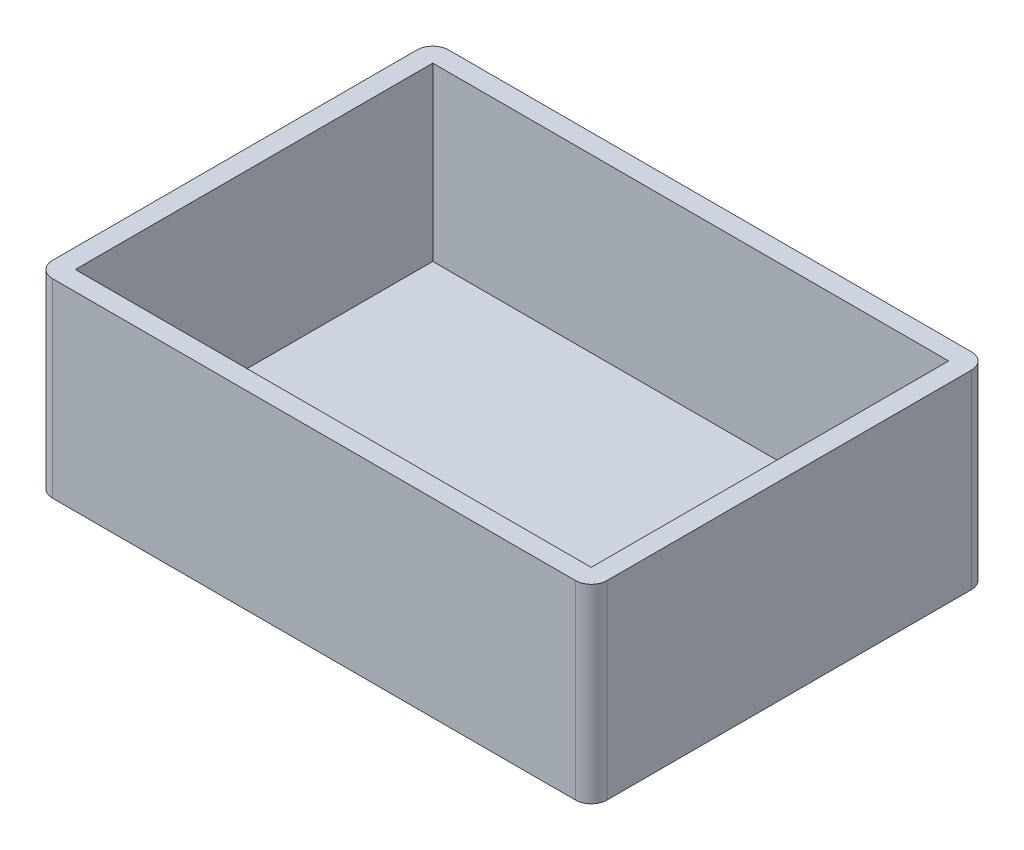
from build123d import *

# Parameters (mm, degrees)
SKETCH1_W                = 350
SKETCH1_H                = 250
SKETCH1_W_2              = 325.6
SKETCH1_H_2              = 225.61
BOSS_EXTRUDE1_DEPTH      = 120
SKETCH1_2_W              = 325.6
SKETCH1_2_H              = 225.61
BOSS_EXTRUDE2_DEPTH      = 11.6
FILLET1_R                = 10
M8_CLEARANCE_HOLE1_D     = 8.4
M8_CLEARANCE_HOLE1_DEPTH = 8
M8_CLEARANCE_HOLE1_TIP   = 2.5236146


with BuildPart() as part:
    # Sketch1 → Boss-Extrude1 (new body)
    with BuildSketch(Plane(origin=(0, 0, 0), x_dir=(1, 0, 0), z_dir=(0, 1, 0))):
        Rectangle(SKETCH1_W, SKETCH1_H)
        Rectangle(SKETCH1_W_2, SKETCH1_H_2, mode=Mode.SUBTRACT)
    extrude(amount=BOSS_EXTRUDE1_DEPTH)

    # Sketch1<2> → Boss-Extrude2 (add)
    with BuildSketch(Plane(origin=(0, 0, 0), x_dir=(1, 0, 0), z_dir=(0, 1, 0))):
        Rectangle(SKETCH1_2_W, SKETCH1_2_H)
    extrude(amount=BOSS_EXTRUDE2_DEPTH)

    # Fillet1
    fillet1_edges = [part.edges().sort_by_distance(p)[0] for p in [
        (175, 60, 125),
        (-175, 60, 125),
        (-175, 60, -125),
        (175, 60, -125),
    ]]
    fillet(fillet1_edges, radius=FILLET1_R)

    # M8 Clearance Hole1
    with Locations(Plane(origin=(0, 0, 0), x_dir=(-1, 0, 0), z_dir=(0, -1, 0))):
        with Locations((155, -105), (-155, -105), (-155, 105), (155, 105)):
            Hole(M8_CLEARANCE_HOLE1_D / 2, depth=M8_CLEARANCE_HOLE1_DEPTH)
            with Locations((0, 0, -(M8_CLEARANCE_HOLE1_DEPTH + M8_CLEARANCE_HOLE1_TIP / 2))):  # 118° drill point
                Cone(0, M8_CLEARANCE_HOLE1_D / 2, M8_CLEARANCE_HOLE1_TIP, mode=Mode.SUBTRACT)


solid = part.part
